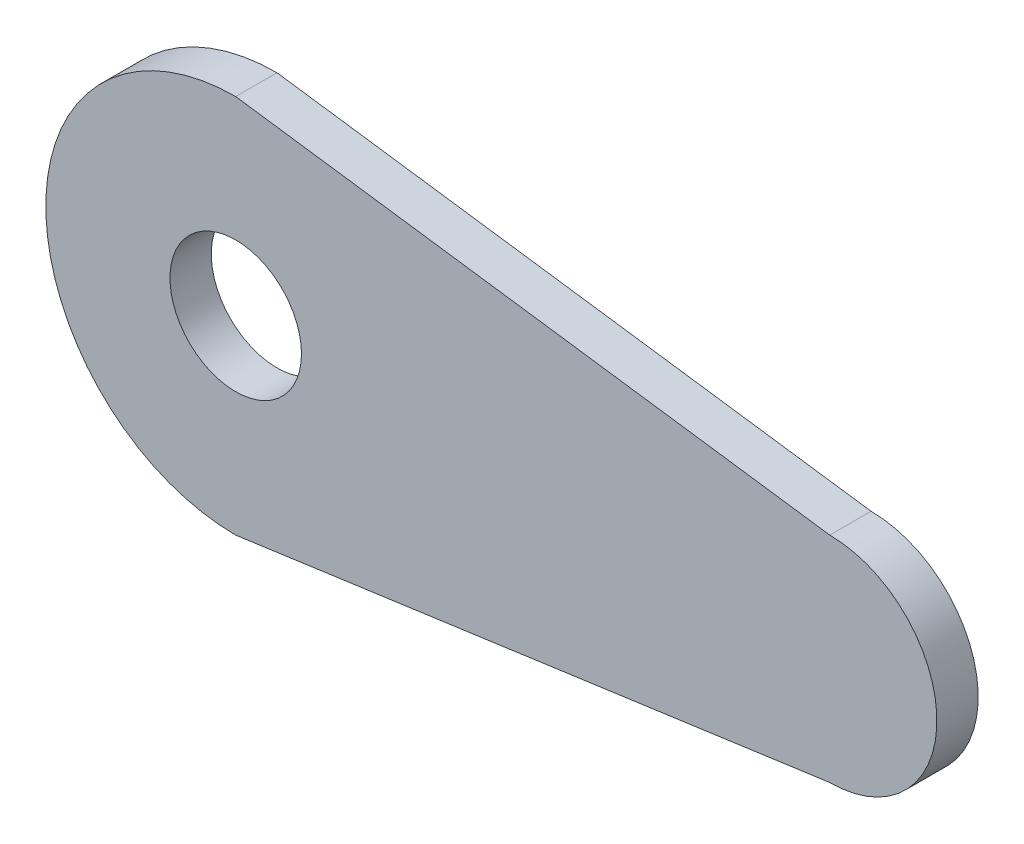
from build123d import *

# Parameters (mm, degrees)
SKETCH3_R           = 39.816395618
BOSS_EXTRUDE2_DEPTH = 25


with BuildPart() as part:
    # Sketch3 → Boss-Extrude2 (new body)
    with BuildSketch(Plane.XY):
        with BuildLine():
            Line((0, -115), (359.738611022, -64.880604201))
            ThreePointArc((359.738611022, -64.880604201), (424.619215223, 0), (359.738611022, 64.880604201))
            Line((359.738611022, 64.880604201), (0, 115))
            ThreePointArc((0, 115), (-115, 0), (0, -115))
        make_face()
        Circle(SKETCH3_R, mode=Mode.SUBTRACT)
    extrude(amount=BOSS_EXTRUDE2_DEPTH)


solid = part.part
